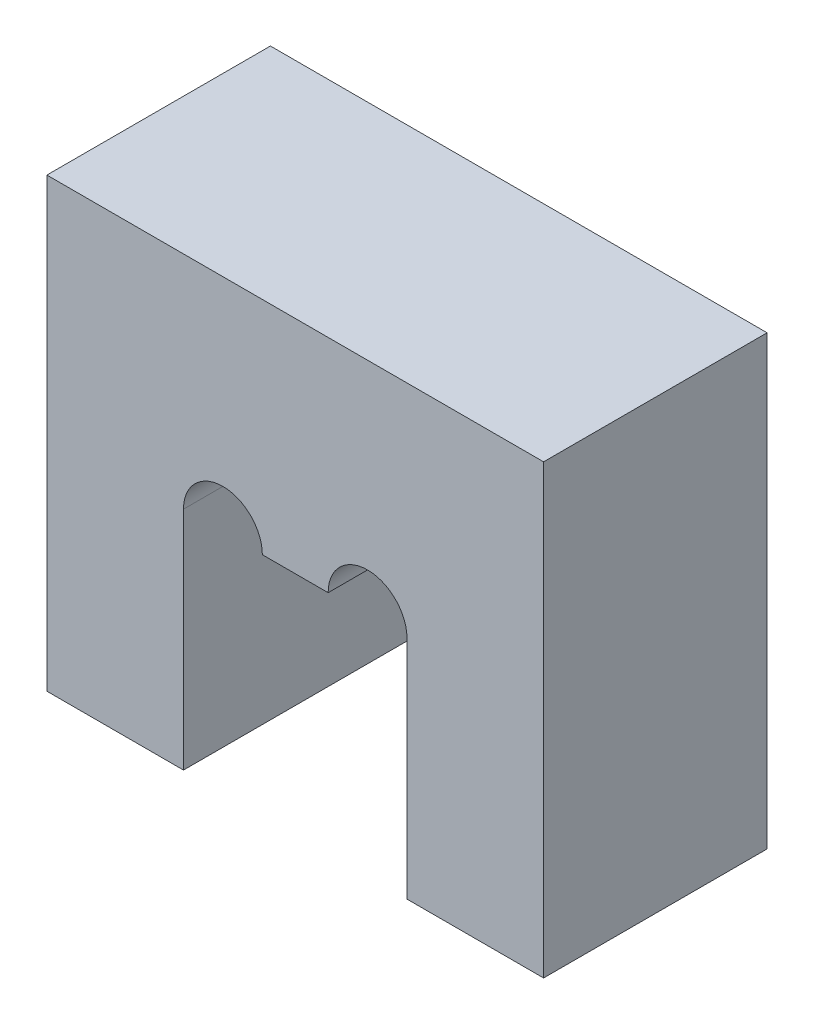
from build123d import *

# Parameters (mm, degrees)
ESTRUSIONE_ESTRUSIONE1_DEPTH = 18


with BuildPart() as part:
    # Schizzo1 → Estrusione-Estrusione1 (new body)
    with BuildSketch(Plane.XY):
        with BuildLine():
            Line((0.437175512, -19.879120879), (11.437175512, -19.879120879))
            Line((11.437175512, -19.879120879), (11.437175512, 16.120879121))
            Line((11.437175512, 16.120879121), (-28.562824488, 16.120879121))
            Line((-28.562824488, 16.120879121), (-28.562824488, -19.879120879))
            Line((-28.562824488, -19.879120879), (-17.562824488, -19.879120879))
            Line((-17.562824488, -19.879120879), (-17.562824488, -1.681318681))
            ThreePointArc((-17.562824488, -1.681318681), (-14.387824488, 1.493681319), (-11.212824488, -1.681318681))
            Line((-11.212824488, -1.681318681), (-5.912824488, -1.681318681))
            ThreePointArc((-5.912824488, -1.681318681), (-2.737824488, 1.493681319), (0.437175512, -1.681318681))
            Line((0.437175512, -1.681318681), (0.437175512, -19.879120879))
        make_face()
    extrude(amount=ESTRUSIONE_ESTRUSIONE1_DEPTH)


solid = part.part
